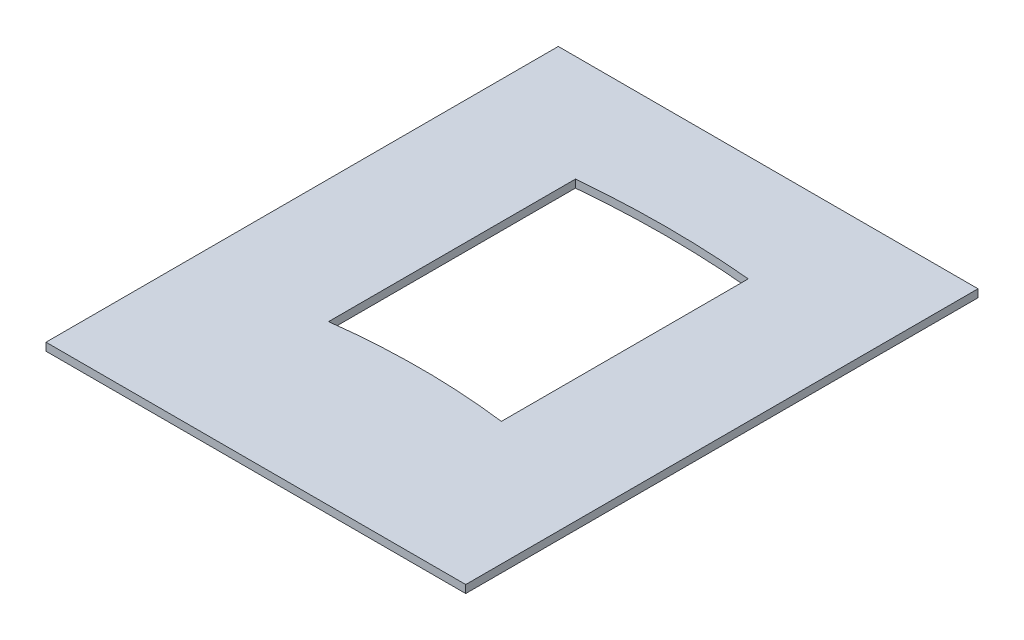
from build123d import *

# Parameters (mm, degrees)
SKETCH1_W           = 6.8
SKETCH1_H           = 8.299485184
BOSS_EXTRUDE1_DEPTH = 0.127


with BuildPart() as part:
    # Sketch1 → Boss-Extrude1 (new body)
    with BuildSketch(Plane(origin=(0, 0, 0), x_dir=(1, 0, 0), z_dir=(0, 1, 0))):
        with Locations((0, 1.572263897)):
            Rectangle(SKETCH1_W, SKETCH1_H)
        with BuildLine():
            Line((-1.4, 4), (-1.4, 0))
            ThreePointArc((-1.4, 0), (0, 0.089454642), (1.4, 0))
            Line((1.4, 0), (1.4, 4))
            ThreePointArc((1.4, 4), (0, 4.065476238), (-1.4, 4))
        make_face(mode=Mode.SUBTRACT)
    extrude(amount=BOSS_EXTRUDE1_DEPTH)


solid = part.part
